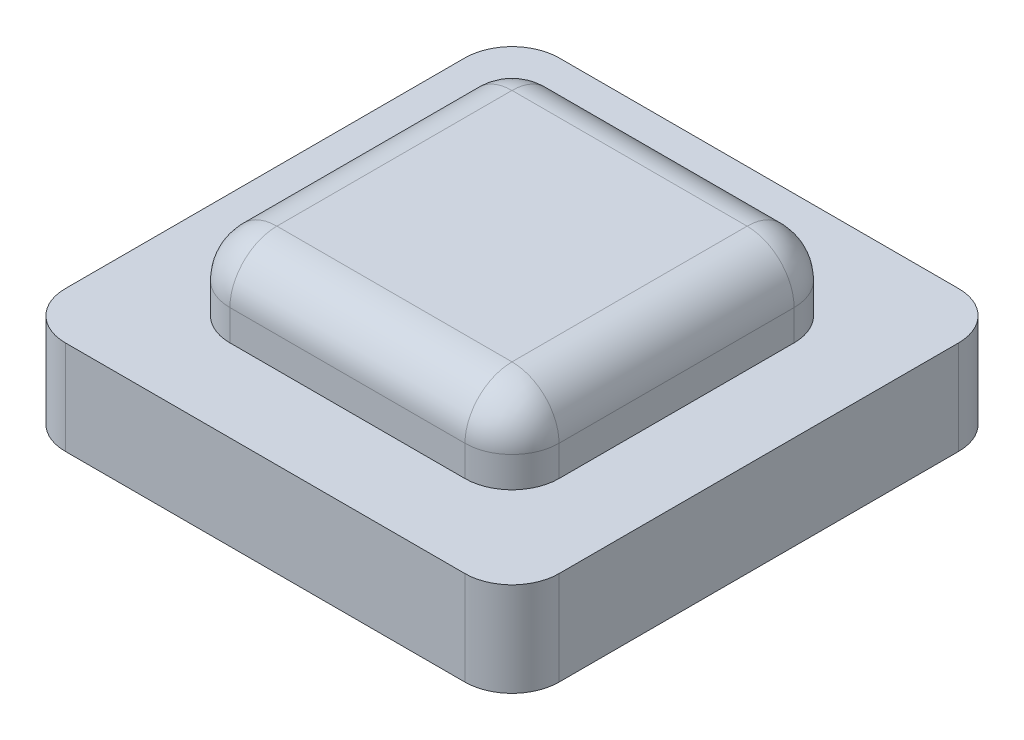
from build123d import *

# Parameters (mm, degrees)
SKETCH1_W           = 21
SKETCH1_H           = 21
BOSS_EXTRUDE1_DEPTH = 4
SKETCH2_W           = 9.5
SKETCH2_H           = 9.5
BOSS_EXTRUDE2_DEPTH = 3.7
SKETCH3_W           = 14
SKETCH3_H           = 14
BOSS_EXTRUDE3_DEPTH = 3.3
FILLET1_R           = 2
FILLET2_R           = 2
FILLET3_R           = 2


with BuildPart() as part:
    # Sketch1 → Boss-Extrude1 (new body)
    with BuildSketch(Plane(origin=(0, 0, 0), x_dir=(1, 0, 0), z_dir=(0, 1, 0))):
        Rectangle(SKETCH1_W, SKETCH1_H)
    extrude(amount=BOSS_EXTRUDE1_DEPTH)

    # Sketch2 → Boss-Extrude2 (add)
    with BuildSketch(Plane.XZ):
        Rectangle(SKETCH2_W, SKETCH2_H)
    extrude(amount=BOSS_EXTRUDE2_DEPTH)

    # Sketch3 → Boss-Extrude3 (add)
    with BuildSketch(Plane(origin=(0, 4, 0), x_dir=(1, 0, 0), z_dir=(0, 1, 0))):
        Rectangle(SKETCH3_W, SKETCH3_H)
    extrude(amount=BOSS_EXTRUDE3_DEPTH)

    # Fillet1
    fillet1_edges = [part.edges().sort_by_distance(p)[0] for p in [
        (10.5, 2, 10.5),
        (-10.5, 2, 10.5),
        (-10.5, 2, -10.5),
        (10.5, 2, -10.5),
    ]]
    fillet(fillet1_edges, radius=FILLET1_R)

    # Fillet2
    fillet2_edges = [part.edges().sort_by_distance(p)[0] for p in [
        (7, 5.65, 7),
        (7, 5.65, -7),
        (-7, 5.65, -7),
        (-7, 5.65, 7),
        (7, 7.3, 0),
        (0, 7.3, -7),
        (-7, 7.3, 0),
        (0, 7.3, 7),
    ]]
    fillet(fillet2_edges, radius=FILLET2_R)

    # Fillet3
    fillet3_edges = [part.edges().sort_by_distance(p)[0] for p in [
        (4.75, -1.85, -4.75),
        (4.75, -1.85, 4.75),
        (-4.75, -1.85, 4.75),
        (-4.75, -1.85, -4.75),
        (4.75, -3.7, 0),
        (0, -3.7, 4.75),
        (-4.75, -3.7, 0),
        (0, -3.7, -4.75),
    ]]
    fillet(fillet3_edges, radius=FILLET3_R)


solid = part.part
